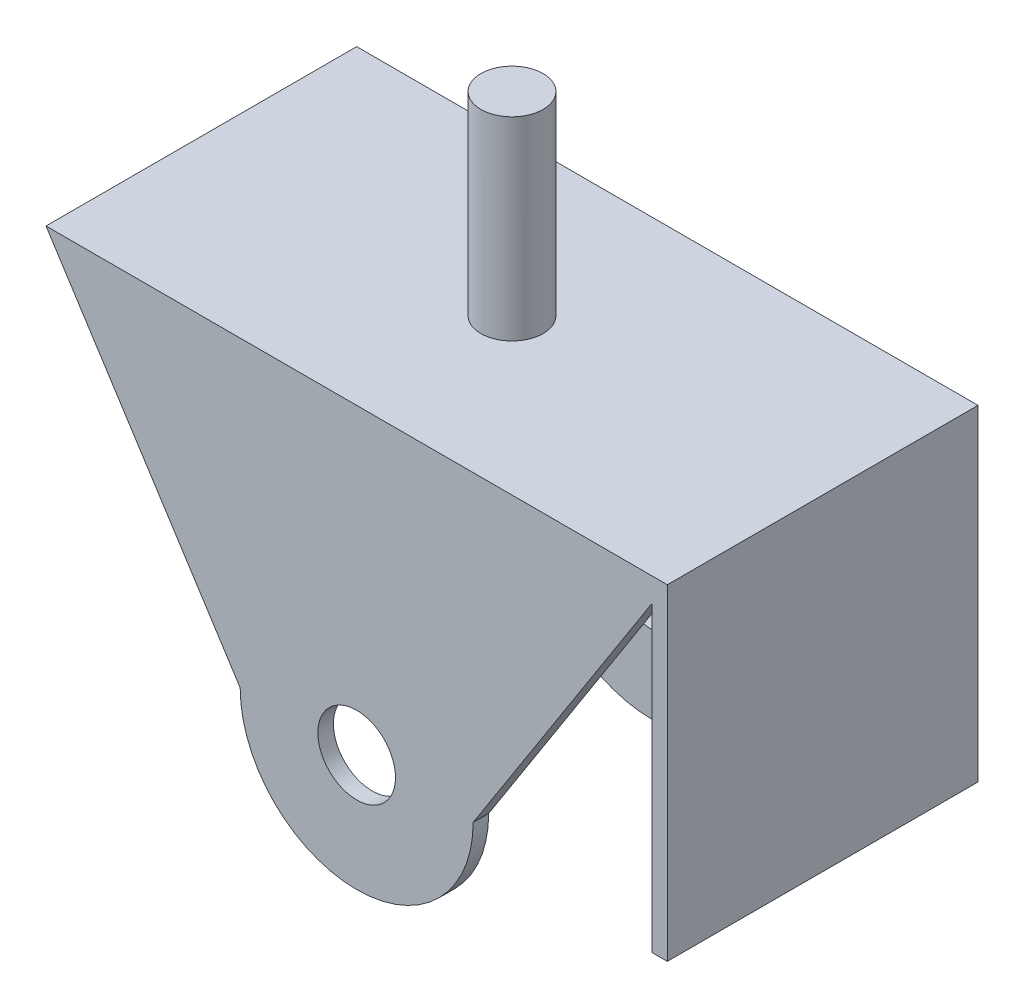
from build123d import *

# Parameters (mm, degrees)
SKETCH_1_R               = 5
EXTRUDE_1_DEPTH          = 40
CUT_EXTRUDE_1_DEPTH      = 18
CUT_EXTRUDE_1_DEPTH_BACK = 18
SKETCH_2_W               = 81.294716022
SKETCH_2_H               = 74
SKETCH_3_R               = 4
EXTRUDE_2_DEPTH          = 25
SKETCH_4_W               = 2
SKETCH_4_H               = 40
EXTRUDE_3_DEPTH          = 42


with BuildPart() as part:
    # 草图1 → 凸台-拉伸1 (new body)
    with BuildSketch(Plane.XY):
        with BuildLine():
            Line((0, 39), (-40, 39))
            Line((-40, 39), (-15, 0))
            ThreePointArc((-15, 0), (0, -15), (15, 0))
            Line((15, 0), (40, 39))
            Line((40, 39), (0, 39))
        make_face()
        Circle(SKETCH_1_R, mode=Mode.SUBTRACT)
    extrude(amount=EXTRUDE_1_DEPTH)

    # 草图2 → 切除-拉伸1 (cut, two sides: drawn at the far end of the back side and taken through both)
    with BuildSketch(Plane.XY.offset(20).offset(-CUT_EXTRUDE_1_DEPTH_BACK)):
        Rectangle(SKETCH_2_W, SKETCH_2_H)
    extrude(amount=CUT_EXTRUDE_1_DEPTH + CUT_EXTRUDE_1_DEPTH_BACK, mode=Mode.SUBTRACT)

    # 草图3 → 凸台-拉伸2 (add)
    with BuildSketch(Plane(origin=(0, 39, 0), x_dir=(1, 0, 0), z_dir=(0, 1, 0))):
        with Locations((0, -20)):
            Circle(SKETCH_3_R)
    extrude(amount=EXTRUDE_2_DEPTH)

    # 草图4 → 凸台-拉伸3 (add)
    with BuildSketch(Plane(origin=(0, 39, 0), x_dir=(1, 0, 0), z_dir=(0, 1, 0))):
        with Locations((39, -20)):
            Rectangle(SKETCH_4_W, SKETCH_4_H)
    extrude(amount=-EXTRUDE_3_DEPTH)


solid = part.part
